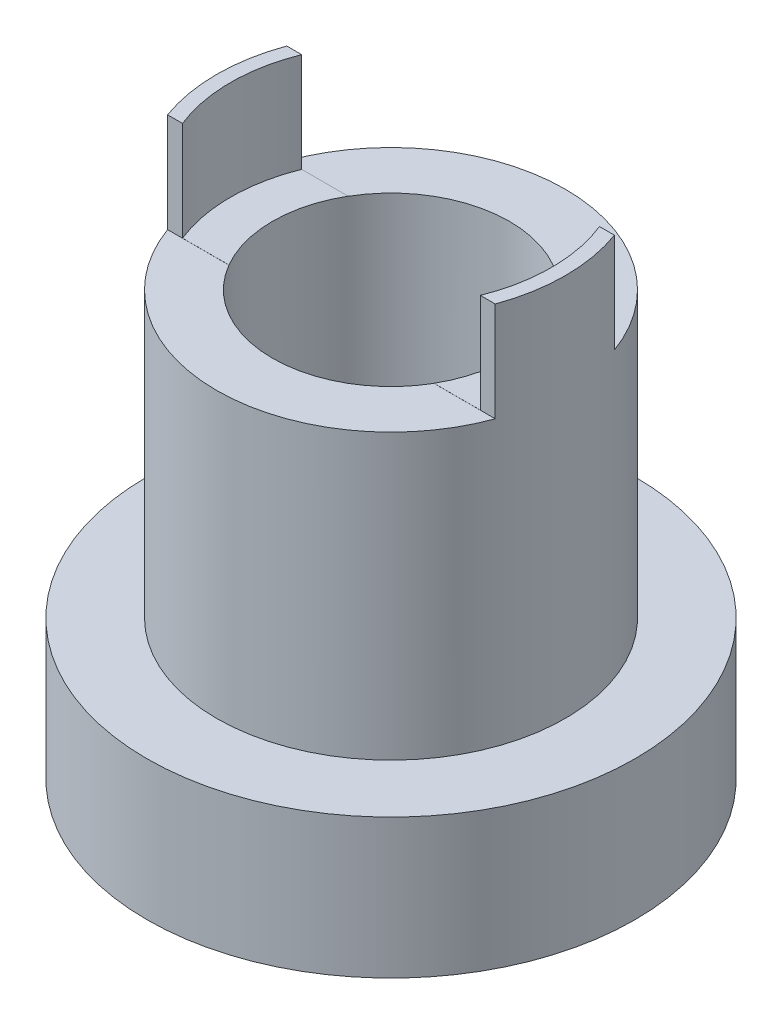
from build123d import *

# Parameters (mm, degrees)
SKETCH_1_R                   = 7
EXTRUDE_1_DEPTH              = 4
SKETCH_5_R                   = 5
EXTRUDE_2_DEPTH              = 11
HOLE_WIZARD_M8_1_D           = 6.8
HOLE_WIZARD_M8_1_ON_FACE_2_D = 6.8
CUT_EXTRUDE_4_DEPTH          = 21.443853316
CUT_EXTRUDE_4_DEPTH_BACK     = 21.443853316
SKETCH_11_W                  = 5.891851166
SKETCH_11_H                  = 2.9
SKETCH_11_W_2                = 4.303127725
SKETCH_12_R                  = 4.6
CUT_EXTRUDE_5_DEPTH          = 2.85


with BuildPart() as part:
    # 草图1 → 凸台-拉伸1 (new body)
    with BuildSketch(Plane(origin=(0, 0, 0), x_dir=(1, 0, 0), z_dir=(0, 1, 0))):
        with Locations(Location((0, 0, 0), (0, 0, 270))):
            Circle(SKETCH_1_R)
    extrude(amount=EXTRUDE_1_DEPTH)

    # 草图5 → 凸台-拉伸2 (add)
    with BuildSketch(Plane(origin=(0, 4, 0), x_dir=(1, 0, 0), z_dir=(0, 1, 0))):
        with Locations(Location((0, 0, 0), (0, 0, 270))):
            Circle(SKETCH_5_R)
    extrude(amount=EXTRUDE_2_DEPTH)

    # M8 螺纹孔1 (through all)
    with Locations(Plane(origin=(0, 0, 0), x_dir=(0, 0, -1), z_dir=(0, -1, 0))):
        with Locations((0, 0)):
            Hole(HOLE_WIZARD_M8_1_D / 2)

    # M8 螺纹孔1 on face 2 (through all)
    with Locations(Plane.ZX.offset(15)):
        with Locations((0, 0)):
            Hole(HOLE_WIZARD_M8_1_ON_FACE_2_D / 2)

    # 草图11 → 切除-拉伸4 (cut, two sides: drawn at the far end of the back side and taken through both)
    with BuildSketch(Plane(origin=(4.997963928, 0, 0), x_dir=(0, 0, -1), z_dir=(1, 0, 0)).offset(-CUT_EXTRUDE_4_DEPTH_BACK)):
        with Locations((4.654854154, 13.597531036)):
            Rectangle(SKETCH_11_W, SKETCH_11_H)
        with Locations((-3.860492434, 13.597531036)):
            Rectangle(SKETCH_11_W_2, SKETCH_11_H)
    extrude(amount=CUT_EXTRUDE_4_DEPTH + CUT_EXTRUDE_4_DEPTH_BACK, mode=Mode.SUBTRACT)

    # 草图12 → 切除-拉伸5 (cut)
    with BuildSketch(Plane(origin=(0, 15, 0), x_dir=(1, 0, 0), z_dir=(0, 1, 0))):
        Circle(SKETCH_12_R)
    extrude(amount=-CUT_EXTRUDE_5_DEPTH, mode=Mode.SUBTRACT)


solid = part.part
